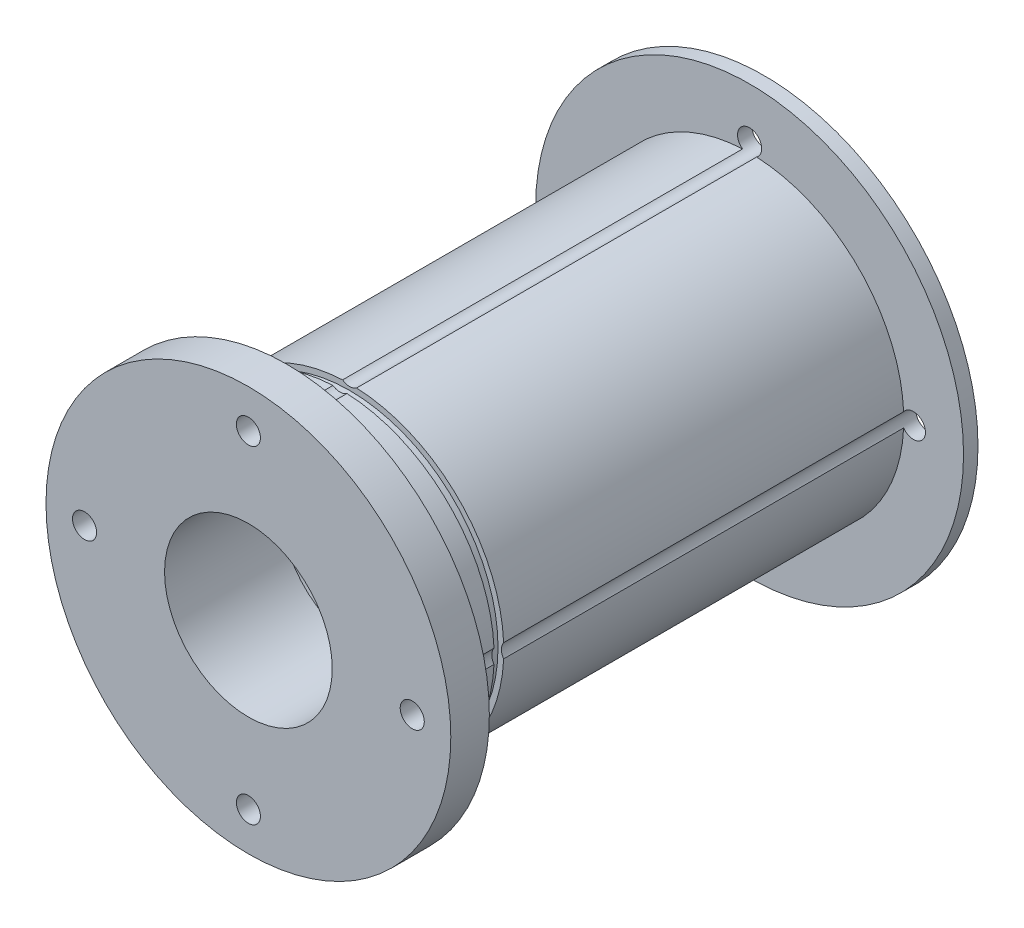
from build123d import *

# Parameters (mm, degrees)
HOLLOW_HUB_START               = -20
SKETCH_1_R                     = 16
SKETCH_1_R_2                   = 8.7
HOLLOW_HUB_DEPTH               = 48
REAR_STACK_FLANGE_START        = -21.5
SKETCH_2_R                     = 22.2
SKETCH_2_R_2                   = 13
REAR_STACK_FLANGE_DEPTH        = 1.5
SUN_MOUNT_FLANGE_START         = 28
SKETCH_3_R                     = 21
SKETCH_3_R_2                   = 8.7
SUN_MOUNT_FLANGE_DEPTH         = 4
REAR_ROTOR_BEARING_SEAT_START  = -20
SKETCH_4_R                     = 13
REAR_ROTOR_BEARING_SEAT_DEPTH  = 5
FRONT_ROTOR_BEARING_SEAT_START = 15
SKETCH_5_R                     = 13
FRONT_ROTOR_BEARING_SEAT_DEPTH = 5
CIRCLIP_GROOVE_START           = 21.5
SKETCH_6_R                     = 17
SKETCH_6_R_2                   = 15.4
CIRCLIP_GROOVE_DEPTH           = 1
SKETCH_7_R                     = 1.25
THROUGH_HOLES_DEPTH            = 100


with BuildPart() as part:
    # Эскиз1 → Hollow_hub (new body)
    with BuildSketch(Plane.XY.offset(HOLLOW_HUB_START)):
        Circle(SKETCH_1_R)
        Circle(SKETCH_1_R_2, mode=Mode.SUBTRACT)
    extrude(amount=HOLLOW_HUB_DEPTH)

    # Эскиз2 → Rear_stack_flange (add)
    with BuildSketch(Plane.XY.offset(REAR_STACK_FLANGE_START)):
        Circle(SKETCH_2_R)
        Circle(SKETCH_2_R_2, mode=Mode.SUBTRACT)
    extrude(amount=REAR_STACK_FLANGE_DEPTH)

    # Эскиз3 → Sun_mount_flange (add)
    with BuildSketch(Plane.XY.offset(SUN_MOUNT_FLANGE_START)):
        Circle(SKETCH_3_R)
        Circle(SKETCH_3_R_2, mode=Mode.SUBTRACT)
    extrude(amount=SUN_MOUNT_FLANGE_DEPTH)

    # Эскиз4 → Rear_rotor_bearing_seat (cut)
    with BuildSketch(Plane.XY.offset(REAR_ROTOR_BEARING_SEAT_START)):
        Circle(SKETCH_4_R)
    extrude(amount=REAR_ROTOR_BEARING_SEAT_DEPTH, mode=Mode.SUBTRACT)

    # Эскиз5 → Front_rotor_bearing_seat (cut)
    with BuildSketch(Plane.XY.offset(FRONT_ROTOR_BEARING_SEAT_START)):
        Circle(SKETCH_5_R)
    extrude(amount=FRONT_ROTOR_BEARING_SEAT_DEPTH, mode=Mode.SUBTRACT)

    # Эскиз6 → Circlip_groove (cut)
    with BuildSketch(Plane.XY.offset(CIRCLIP_GROOVE_START)):
        Circle(SKETCH_6_R)
        Circle(SKETCH_6_R_2, mode=Mode.SUBTRACT)
    extrude(amount=CIRCLIP_GROOVE_DEPTH, mode=Mode.SUBTRACT)

    # Эскиз7 → Through_holes (cut, symmetric)
    with BuildSketch(Plane.XY):
        with Locations((17, 0)):
            Circle(SKETCH_7_R)
        with Locations((0, 17)):
            Circle(SKETCH_7_R)
        with Locations((-17, 0)):
            Circle(SKETCH_7_R)
        with Locations((0, -17)):
            Circle(SKETCH_7_R)
    extrude(amount=THROUGH_HOLES_DEPTH, both=True, mode=Mode.SUBTRACT)


solid = part.part
